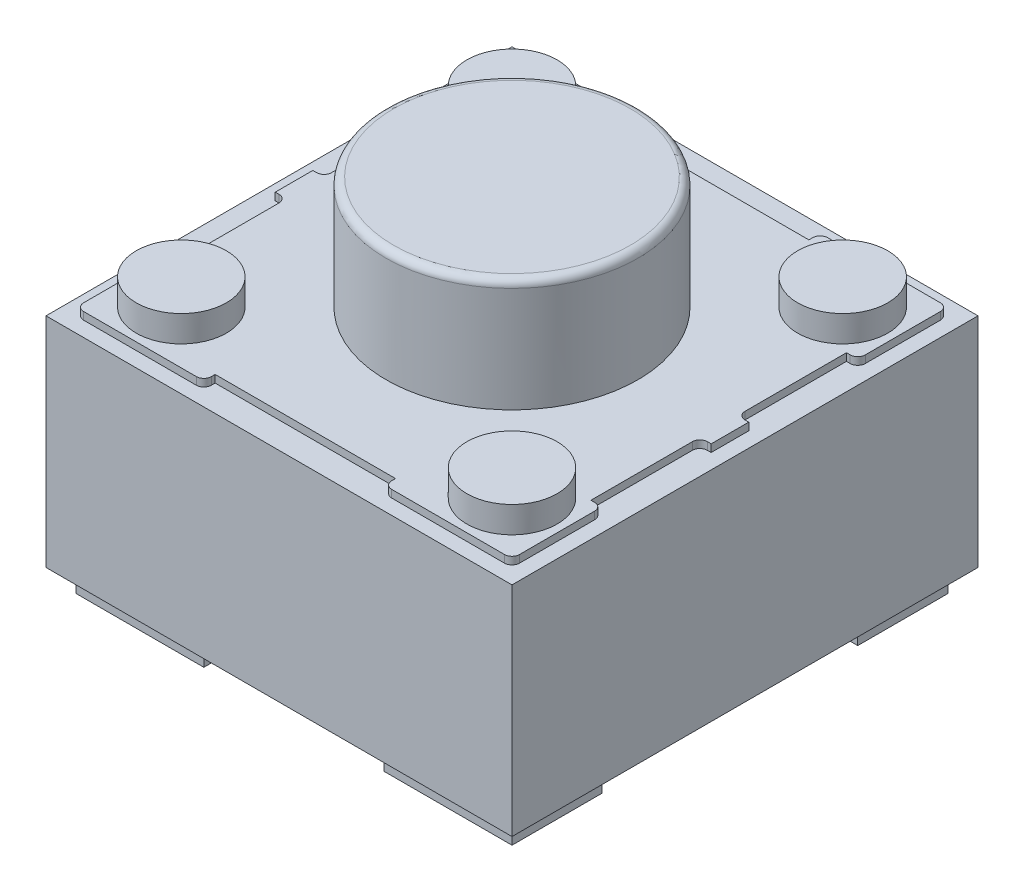
from build123d import *

# Parameters (mm, degrees)
ESQUISSE1_W             = 1.7
ESQUISSE1_H             = 1.2
BOSS_EXTRU_1_DEPTH      = 0.3
BOSS_EXTRU_1_2_DEPTH    = 0.3
BOSS_EXTRU_1_3_DEPTH    = 0.3
BOSS_EXTRU_1_4_DEPTH    = 0.3
ESQUISSE2_W             = 6.2
ESQUISSE2_H             = 6.2
BOSS_EXTRU_2_DEPTH      = 3
ESQUISSE3_W             = 6.2
ESQUISSE3_H             = 6.2
ENL_V_MAT_EXTRU_1_DEPTH = 0.1
ESQUISSE4_R             = 0.6
BOSS_EXTRU_3_DEPTH      = 0.35
ESQUISSE5_R             = 1.675
BOSS_EXTRU_4_DEPTH      = 1.5
CONG_1_R                = 0.1


with BuildPart() as part:
    # Esquisse1 → Boss.-Extru.1 (new body)
    with BuildSketch(Plane(origin=(0, 0, 0), x_dir=(1, 0, 0), z_dir=(0, 1, 0))):
        with Locations((1.05, 0.8)):
            Rectangle(ESQUISSE1_W, ESQUISSE1_H)
    extrude(amount=BOSS_EXTRU_1_DEPTH)



with BuildPart() as body_2:
    # Esquisse1 → Boss.-Extru.1 2 (new body)
    with BuildSketch(Plane(origin=(0, 0, 0), x_dir=(1, 0, 0), z_dir=(0, 1, 0))):
        with Locations((1.05, 5.4)):
            Rectangle(ESQUISSE1_W, ESQUISSE1_H)
    extrude(amount=BOSS_EXTRU_1_2_DEPTH)


with BuildPart() as body_3:
    # Esquisse1 → Boss.-Extru.1 3 (new body)
    with BuildSketch(Plane(origin=(0, 0, 0), x_dir=(1, 0, 0), z_dir=(0, 1, 0))):
        with Locations((5.15, 5.4)):
            Rectangle(ESQUISSE1_W, ESQUISSE1_H)
    extrude(amount=BOSS_EXTRU_1_3_DEPTH)


with BuildPart() as body_4:
    # Esquisse1 → Boss.-Extru.1 4 (new body)
    with BuildSketch(Plane(origin=(0, 0, 0), x_dir=(1, 0, 0), z_dir=(0, 1, 0))):
        with Locations((5.15, 0.8)):
            Rectangle(ESQUISSE1_W, ESQUISSE1_H)
    extrude(amount=BOSS_EXTRU_1_4_DEPTH)


with BuildPart() as part_1:
    add(part.part)

    add(body_2.part)  # Boss.-Extru.2 merges body 2

    add(body_3.part)  # Boss.-Extru.2 merges body 3

    add(body_4.part)  # Boss.-Extru.2 merges body 4
    # Esquisse2 → Boss.-Extru.2 (add)
    with BuildSketch(Plane(origin=(0, 0.3, 0), x_dir=(1, 0, 0), z_dir=(0, 1, 0))):
        with Locations((3.1, 3.1)):
            Rectangle(ESQUISSE2_W, ESQUISSE2_H)
    extrude(amount=BOSS_EXTRU_2_DEPTH)

    # Esquisse3 → Enlèv. mat.-Extru.1 (cut)
    with BuildSketch(Plane(origin=(0, 3.3, 0), x_dir=(1, 0, 0), z_dir=(0, 1, 0))):
        with Locations((3.1, 3.1)):
            Rectangle(ESQUISSE3_W, ESQUISSE3_H)
        with BuildLine():
            Line((0.3, 6), (1.8, 6))
            ThreePointArc((1.8, 6), (1.870710678, 5.970710678), (1.9, 5.9))
            Line((1.9, 5.9), (1.9, 5.85))
            Line((1.9, 5.85), (4.3, 5.85))
            Line((4.3, 5.85), (4.3, 5.9))
            ThreePointArc((4.3, 5.9), (4.329289322, 5.970710678), (4.4, 6))
            Line((4.4, 6), (5.9, 6))
            ThreePointArc((5.9, 6), (5.970710678, 5.970710678), (6, 5.9))
            Line((6, 5.9), (6, 4.9))
            ThreePointArc((6, 4.9), (5.970710678, 4.829289322), (5.9, 4.8))
            Line((5.9, 4.8), (5.85, 4.8))
            Line((5.85, 4.8), (5.85, 3.45))
            ThreePointArc((5.85, 3.45), (5.879289322, 3.379289322), (5.95, 3.35))
            Line((5.95, 3.35), (6, 3.35))
            Line((6, 3.35), (6, 2.85))
            Line((6, 2.85), (5.95, 2.85))
            ThreePointArc((5.95, 2.85), (5.879289322, 2.820710678), (5.85, 2.75))
            Line((5.85, 2.75), (5.85, 1.4))
            Line((5.85, 1.4), (5.9, 1.4))
            ThreePointArc((5.9, 1.4), (5.970710678, 1.370710678), (6, 1.3))
            Line((6, 1.3), (6, 0.3))
            ThreePointArc((6, 0.3), (5.970710678, 0.229289322), (5.9, 0.2))
            Line((5.9, 0.2), (4.4, 0.2))
            ThreePointArc((4.4, 0.2), (4.329289322, 0.229289322), (4.3, 0.3))
            Line((4.3, 0.3), (4.3, 0.35))
            Line((4.3, 0.35), (1.9, 0.35))
            Line((1.9, 0.35), (1.9, 0.3))
            ThreePointArc((1.9, 0.3), (1.870710678, 0.229289322), (1.8, 0.2))
            Line((1.8, 0.2), (0.3, 0.2))
            ThreePointArc((0.3, 0.2), (0.229289322, 0.229289322), (0.2, 0.3))
            Line((0.2, 0.3), (0.2, 1.3))
            ThreePointArc((0.2, 1.3), (0.229289322, 1.370710678), (0.3, 1.4))
            Line((0.3, 1.4), (0.35, 1.4))
            Line((0.35, 1.4), (0.35, 2.75))
            ThreePointArc((0.35, 2.75), (0.320710678, 2.820710678), (0.25, 2.85))
            Line((0.25, 2.85), (0.2, 2.85))
            Line((0.2, 2.85), (0.2, 3.35))
            Line((0.2, 3.35), (0.25, 3.35))
            ThreePointArc((0.25, 3.35), (0.320710678, 3.379289322), (0.35, 3.45))
            Line((0.35, 3.45), (0.35, 4.8))
            Line((0.35, 4.8), (0.3, 4.8))
            ThreePointArc((0.3, 4.8), (0.229289322, 4.829289322), (0.2, 4.9))
            Line((0.2, 4.9), (0.2, 5.9))
            ThreePointArc((0.2, 5.9), (0.229289322, 5.970710678), (0.3, 6))
        make_face(mode=Mode.SUBTRACT)
    extrude(amount=-ENL_V_MAT_EXTRU_1_DEPTH, mode=Mode.SUBTRACT)

    # Esquisse4 → Boss.-Extru.3 (add)
    with BuildSketch(Plane(origin=(0, 3.3, 0), x_dir=(1, 0, 0), z_dir=(0, 1, 0))):
        with Locations((0.9, 5.3)):
            Circle(ESQUISSE4_R)
        with Locations((5.3, 5.3)):
            Circle(ESQUISSE4_R)
        with Locations((0.9, 0.9)):
            Circle(ESQUISSE4_R)
        with Locations((5.3, 0.9)):
            Circle(ESQUISSE4_R)
    extrude(amount=BOSS_EXTRU_3_DEPTH)

    # Esquisse5 → Boss.-Extru.4 (add)
    with BuildSketch(Plane(origin=(0, 3.3, 0), x_dir=(1, 0, 0), z_dir=(0, 1, 0))):
        with Locations((3.1, 3.1)):
            Circle(ESQUISSE5_R)
    extrude(amount=BOSS_EXTRU_4_DEPTH)

    # Congé1
    cong_1_edges = [part_1.edges().sort_by_distance(p)[0] for p in [
        (1.425, 4.8, -3.1),
    ]]
    fillet(cong_1_edges, radius=CONG_1_R)


solid = part_1.part
